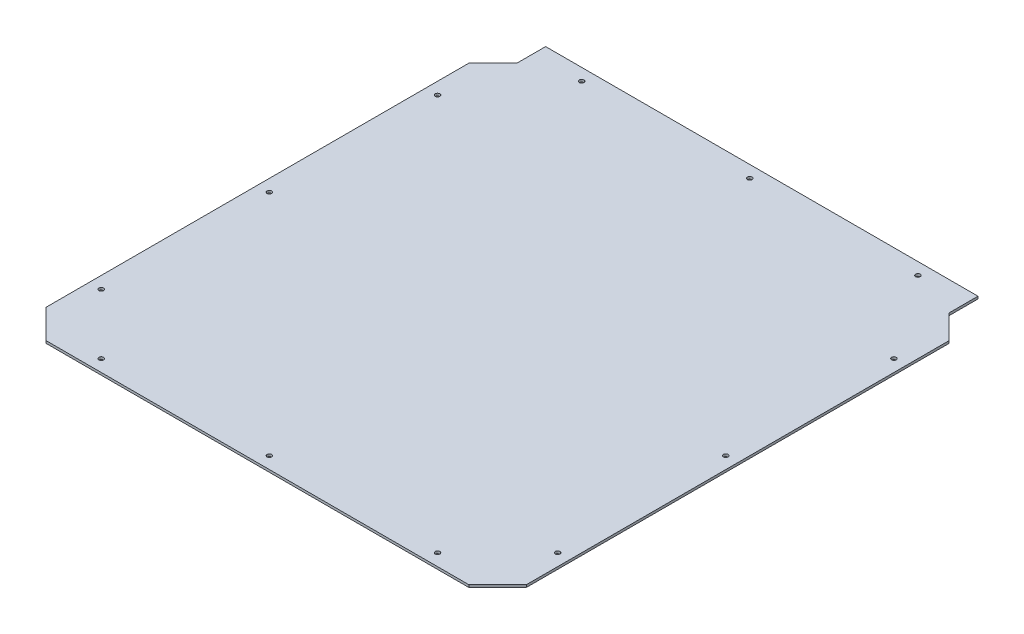
from build123d import *

# Parameters (mm, degrees)
SKETCH1_W            = 600
SKETCH1_H            = 630
BOSS_EXTRUDE1_DEPTH  = 1.5
CUT_EXTRUDE1_DEPTH   = 436.010344705
M5_CLEARANCE_HOLE2_D = 5.8


with BuildPart() as part:
    # Sketch1 → Boss-Extrude1 (new, symmetric)
    with BuildSketch(Plane(origin=(0, 0, 0), x_dir=(1, 0, 0), z_dir=(0, 1, 0))):
        Rectangle(SKETCH1_W, SKETCH1_H)
    extrude(amount=BOSS_EXTRUDE1_DEPTH, both=True)

    # Sketch2 → Cut-Extrude1 (cut, through all)
    with BuildSketch(Plane(origin=(0, 1.5, 0), x_dir=(1, 0, 0), z_dir=(0, 1, 0))):
        Polygon((270, 315), (270, 279), (300, 249), (300, 315), align=None)
        Polygon((-270, 315), (-300, 315), (-300, 249), (-270, 279), align=None)
        Polygon((-300, -315), (-300, -279), (-264, -315), align=None)
        Polygon((264, -315), (300, -315), (300, -279), align=None)
    extrude(amount=-CUT_EXTRUDE1_DEPTH, mode=Mode.SUBTRACT)

    # M5 Clearance Hole2 (through all)
    with Locations(Plane(origin=(0, 1.5, 0), x_dir=(1, 0, 0), z_dir=(0, 1, 0))):
        with Locations((-210, 300), (0, 300), (210, 300), (285, 195), (285, -15), (285, -225), (210, -300), (0, -300), (-210, -300), (-285, -225), (-285, -15), (-285, 195)):
            Hole(M5_CLEARANCE_HOLE2_D / 2)


solid = part.part
